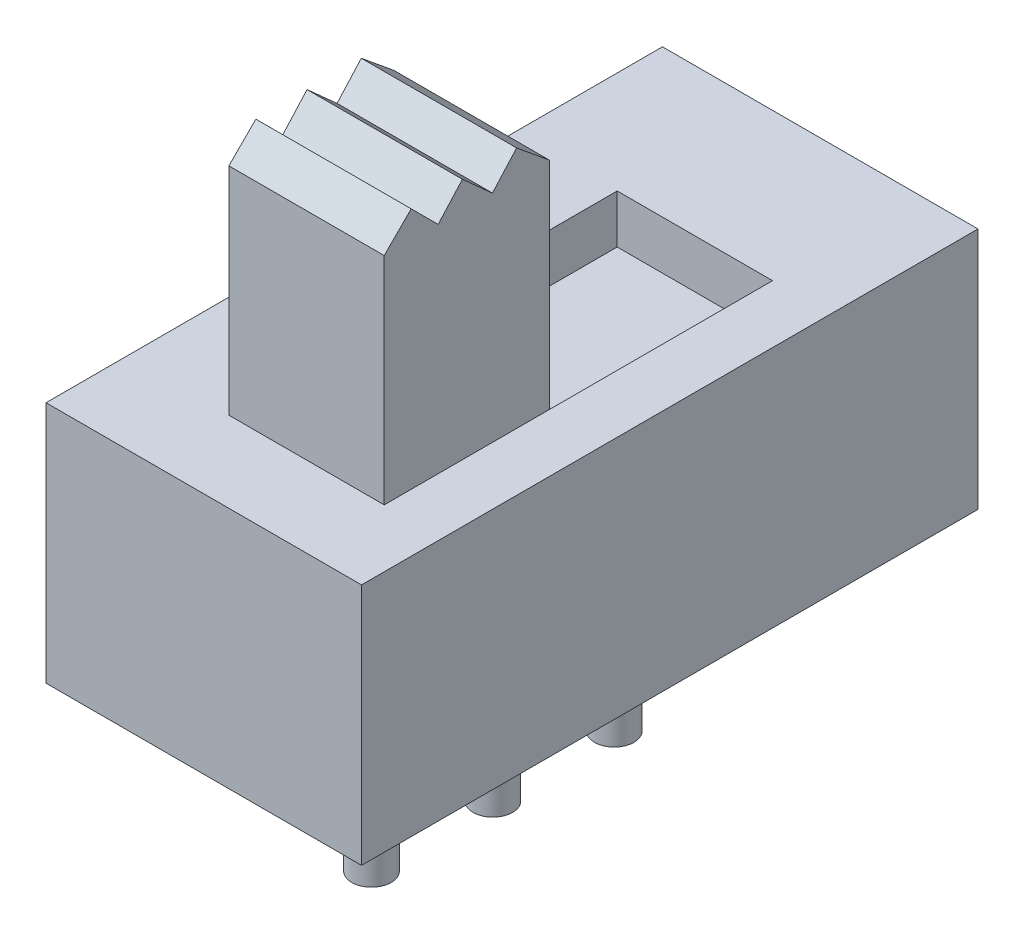
from build123d import *

# Parameters (mm, degrees)
SKETCH1_W           = 6.5
SKETCH1_H           = 12.7
BOSS_EXTRUDE1_DEPTH = 5.0038
SKETCH2_W           = 3.2004
SKETCH2_H           = 3.4036
BOSS_EXTRUDE2_DEPTH = 5.0038
SKETCH3_W           = 3.2004
SKETCH3_H           = 4.5964
CUT_EXTRUDE1_DEPTH  = 1
CUT_EXTRUDE2_DEPTH  = 11
SKETCH5_R           = 0.4064
BOSS_EXTRUDE3_DEPTH = 3


with BuildPart() as part:
    # Sketch1 → Boss-Extrude1 (new body)
    with BuildSketch(Plane(origin=(0, 0, 0), x_dir=(1, 0, 0), z_dir=(0, 1, 0))):
        with Locations((-3.25, 6.35)):
            Rectangle(SKETCH1_W, SKETCH1_H)
    extrude(amount=BOSS_EXTRUDE1_DEPTH)

    # Sketch2 → Boss-Extrude2 (add)
    with BuildSketch(Plane(origin=(0, 5.0038, 0), x_dir=(1, 0, 0), z_dir=(0, 1, 0))):
        with Locations((-2.794, 3.363221349)):
            Rectangle(SKETCH2_W, SKETCH2_H)
    extrude(amount=BOSS_EXTRUDE2_DEPTH)

    # Sketch3 → Cut-Extrude1 (cut)
    with BuildSketch(Plane(origin=(0, 5.0038, 0), x_dir=(1, 0, 0), z_dir=(0, 1, 0))):
        with Locations((-2.794, 7.363221349)):
            Rectangle(SKETCH3_W, SKETCH3_H)
    extrude(amount=-CUT_EXTRUDE1_DEPTH, mode=Mode.SUBTRACT)

    # Sketch4 → Cut-Extrude2 (cut)
    with BuildSketch(Plane(origin=(-1.1938, 0, 0), x_dir=(0, 0, -1), z_dir=(1, 0, 0))):
        Polygon((1.661421349, 10.0076), (1.661421349, 9.45189334), (2.217128008, 10.0076), align=None)
        Polygon((3.271843346, 10.0076), (2.217128008, 10.0076), (2.772834668, 9.45189334), align=None)
        Polygon((4.38969876, 10.0076), (3.271843346, 10.0076), (3.890690082, 9.45189334), align=None)
        Polygon((5.065021349, 10.0076), (4.38969876, 10.0076), (5.065021349, 9.45189334), align=None)
    extrude(amount=-CUT_EXTRUDE2_DEPTH, mode=Mode.SUBTRACT)

    # Sketch5 → Boss-Extrude3 (add)
    with BuildSketch(Plane(origin=(0, 0, 0), x_dir=(-1, 0, 0), z_dir=(0, -1, 0))):
        with Locations(Location((2.794, 3, 0), (0, 0, 270))):
            Circle(SKETCH5_R)
        with Locations(Location((2.794, 5.5, 0), (0, 0, 270))):
            Circle(SKETCH5_R)
        with Locations(Location((2.794, 8, 0), (0, 0, 270))):
            Circle(SKETCH5_R)
    extrude(amount=BOSS_EXTRUDE3_DEPTH)


solid = part.part
